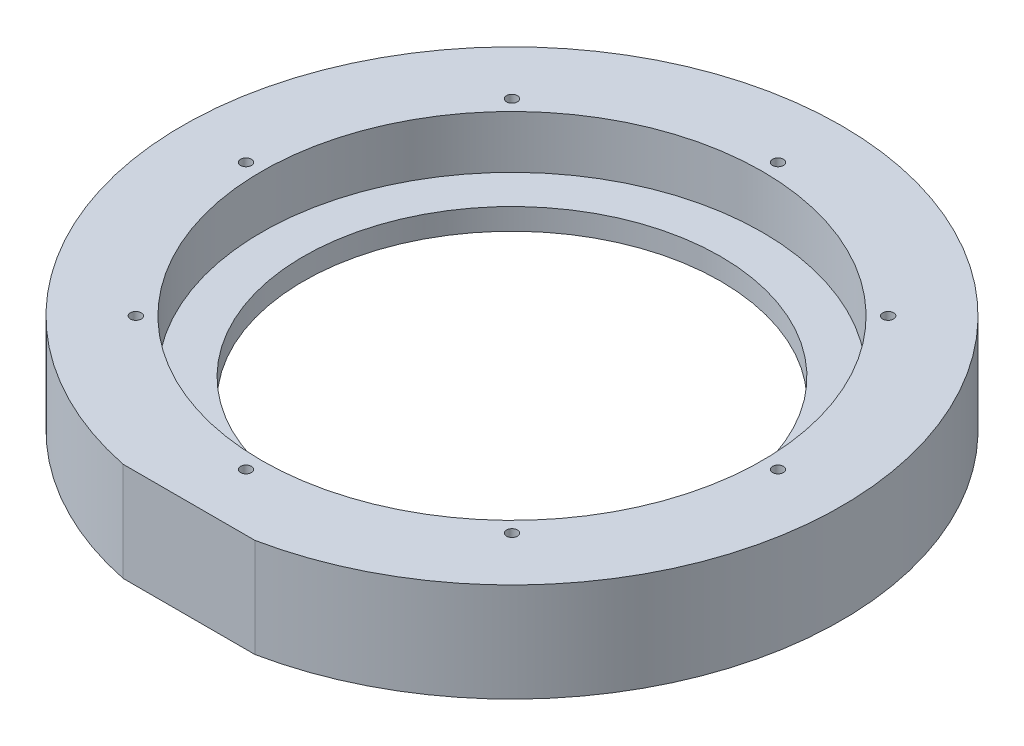
from build123d import *

# Parameters (mm, degrees)
M5X0_8_TAPPED_HOLE1_D     = 4.2
M5X0_8_TAPPED_HOLE1_DEPTH = 17.399
M5X0_8_TAPPED_HOLE1_TIP   = 1.2618073
CUT_EXTRUDE1_REACH        = 185.602
SKETCH7_W                 = 50.8
SKETCH7_H                 = 2.565921067
F_8_32_TAPPED_HOLE1_D     = 3.4544


with BuildPart() as part:
    # Sketch1 → Revolve1 (revolve)
    with BuildSketch(Plane.XY, mode=Mode.PRIVATE) as revolve1_sk:
        Polygon((80.3783, 0), (99.4283, 0), (99.4283, -6.985), (109.7915, -6.985), (109.7915, -9.525), (127, -9.525), (127, 28.575), (96.5, 28.575), (96.5, 8.255), (80.3783, 8.255), align=None)
    revolve(revolve1_sk.sketch.rotate(Axis((0, 0, 0), (0, 1, 0)), 90), axis=Axis((0, 0, 0), (0, 1, 0)))

    # M5x0.8 Tapped Hole1
    with Locations(Plane(origin=(0, 28.575, 0), x_dir=(1, 0, 0), z_dir=(0, 1, 0))):
        with Locations((0, 102.5), (72.478445072, 72.478445072), (102.5, 0), (72.478445072, -72.478445072), (0, -102.5), (-72.478445072, -72.478445072), (-102.5, 0), (-72.478445072, 72.478445072)):
            Hole(M5X0_8_TAPPED_HOLE1_D / 2, depth=M5X0_8_TAPPED_HOLE1_DEPTH)
            with Locations((0, 0, -(M5X0_8_TAPPED_HOLE1_DEPTH + M5X0_8_TAPPED_HOLE1_TIP / 2))):  # 118° drill point
                Cone(0, M5X0_8_TAPPED_HOLE1_D / 2, M5X0_8_TAPPED_HOLE1_TIP, mode=Mode.SUBTRACT)

    # Sketch7 → Cut-Extrude1 (cut, up to next)
    with BuildSketch(Plane(origin=(0, 28.575, 0), x_dir=(1, 0, 0), z_dir=(0, 1, 0)), mode=Mode.PRIVATE) as cut_extrude1_sk1:
        with Locations((0, -125.717039467)):
            Rectangle(SKETCH7_W, SKETCH7_H)
    cut_extrude1_tool1 = extrude(cut_extrude1_sk1.sketch, amount=-CUT_EXTRUDE1_REACH, mode=Mode.PRIVATE) & part.part
    add(cut_extrude1_tool1.solids().sort_by_distance((0, 28.575, 125.717039))[0], mode=Mode.SUBTRACT)

    # #8-32 Tapped Hole1 (through all)
    with Locations(Plane(origin=(0, 0, 0), x_dir=(-1, 0, 0), z_dir=(0, -1, 0))):
        with Locations((-6.35, -85.09), (6.35, -85.09)):
            Hole(F_8_32_TAPPED_HOLE1_D / 2)


solid = part.part
